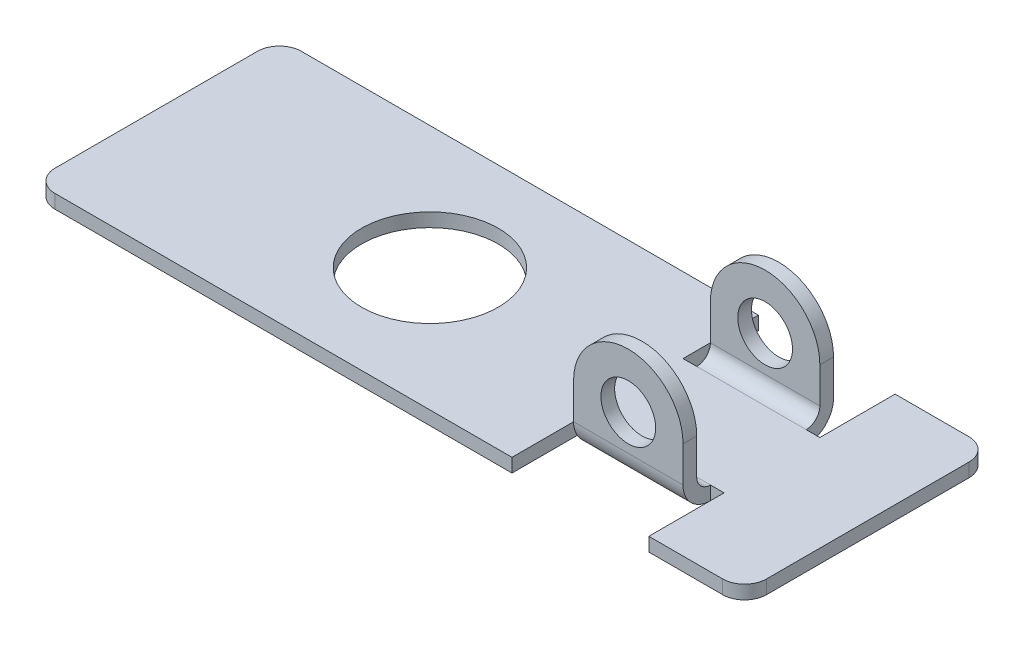
from build123d import *

# Parameters (mm, degrees)
SKETCH_1_R      = 2.5
EXTRUDE_1_DEPTH = 0.5
EXTRUDE_START   = 2.75
SKETCH_2_R      = 1
EXTRUDE_2_DEPTH = 0.5
EXTRUDE_START_2 = -2.25
SKETCH_2_2_R    = 1
EXTRUDE_3_DEPTH = 0.5
FILLET_1_R      = 0.8
FILLET_2_R      = 0.5
FILLET_4_R      = 1


with BuildPart() as part:
    # Эскиз1 → Бобышка-Вытянуть1 (new body)
    with BuildSketch(Plane(origin=(0, 0, 0), x_dir=(1, 0, 0), z_dir=(0, 1, 0))):
        Polygon((-10, 4.5), (7.5, 4.5), (7.5, 1.75), (8, 1.75), (8, 2.75), (12, 2.75), (12, 1.75), (12.5, 1.75), (12.5, 4.5), (16, 4.5), (16, -4.5), (12.5, -4.5), (12.5, -1.75), (12, -1.75), (12, -2.75), (8, -2.75), (8, -1.75), (7.5, -1.75), (7.5, -4.5), (-10, -4.5), align=None)
        with Locations(Location((0, 0, 0), (0, 0, 270))):
            Circle(SKETCH_1_R, mode=Mode.SUBTRACT)
    extrude(amount=EXTRUDE_1_DEPTH)

    # Эскиз2 → Бобышка-Вытянуть2 (add)
    with BuildSketch(Plane.XY.offset(EXTRUDE_START)):
        with BuildLine():
            Line((8, 0.5), (8, 2.3))
            ThreePointArc((8, 2.3), (10, 4.3), (12, 2.3))
            Line((12, 2.3), (12, 0.5))
            Line((12, 0.5), (8, 0.5))
        make_face()
        with Locations(Location((10, 2.3, 0), (0, 0, 180))):
            Circle(SKETCH_2_R, mode=Mode.SUBTRACT)
    extrude(amount=-EXTRUDE_2_DEPTH)

    # Эскиз2<2> → Бобышка-Вытянуть3 (add)
    with BuildSketch(Plane.XY.offset(EXTRUDE_START_2)):
        with BuildLine():
            Line((8, 0.5), (8, 2.3))
            ThreePointArc((8, 2.3), (10, 4.3), (12, 2.3))
            Line((12, 2.3), (12, 0.5))
            Line((12, 0.5), (8, 0.5))
        make_face()
        with Locations(Location((10, 2.3, 0), (0, 0, 180))):
            Circle(SKETCH_2_2_R, mode=Mode.SUBTRACT)
    extrude(amount=-EXTRUDE_3_DEPTH)

    # Скругление1
    fillet_1_edges = [part.edges().sort_by_distance(p)[0] for p in [
        (-10, 0.25, 4.5),
        (-10, 0.25, -4.5),
        (16, 0.25, -4.5),
        (16, 0.25, 4.5),
    ]]
    fillet(fillet_1_edges, radius=FILLET_1_R)

    # Скругление2
    fillet_2_edges = [part.edges().sort_by_distance(p)[0] for p in [
        (10, 0.5, 2.25),
        (10, 0.5, -2.25),
    ]]
    fillet(fillet_2_edges, radius=FILLET_2_R)

    # Скругление4
    fillet_4_edges = [part.edges().sort_by_distance(p)[0] for p in [
        (10, 0, 2.75),
        (10, 0, -2.75),
    ]]
    fillet(fillet_4_edges, radius=FILLET_4_R)


solid = part.part
